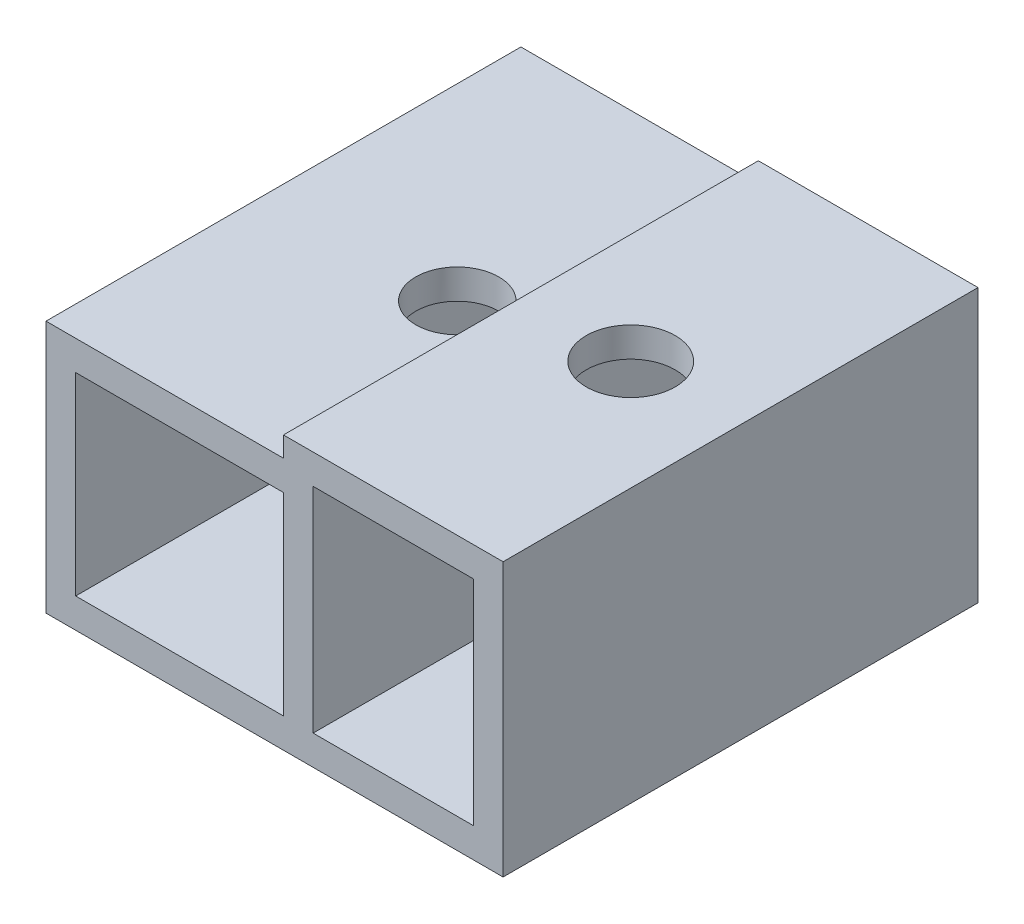
from build123d import *

# Parameters (mm, degrees)
SKETCH1_W           = 44.45
SKETCH1_H           = 41.402
SKETCH1_W_2         = 34.29
SKETCH1_H_2         = 45.72
BOSS_EXTRUDE1_DEPTH = 101.6
SKETCH2_R           = 9.525
CUT_EXTRUDE1_DEPTH  = 12.7
SKETCH3_R           = 8.89
CUT_EXTRUDE2_DEPTH  = 12.7
SKETCH4_R           = 8.5725
CUT_EXTRUDE3_DEPTH  = 12.7


with BuildPart() as part:
    # Sketch1 → Boss-Extrude1 (new body)
    with BuildSketch(Plane.XY):
        Polygon((0, 0), (97.79, 0), (97.79, 58.42), (50.8, 58.42), (50.8, 54.102), (0, 54.102), align=None)
        with Locations((28.575, 27.051)):
            Rectangle(SKETCH1_W, SKETCH1_H, mode=Mode.SUBTRACT)
        with Locations((74.295, 29.21)):
            Rectangle(SKETCH1_W_2, SKETCH1_H_2, mode=Mode.SUBTRACT)
    extrude(amount=BOSS_EXTRUDE1_DEPTH)

    # Sketch2 → Cut-Extrude1 (cut)
    with BuildSketch(Plane(origin=(0, 58.42, 0), x_dir=(1, 0, 0), z_dir=(0, 1, 0))):
        with Locations(Location((74.295, -50.8, 0), (0, 0, 180))):
            Circle(SKETCH2_R)
    extrude(amount=-CUT_EXTRUDE1_DEPTH, mode=Mode.SUBTRACT)

    # Sketch3 → Cut-Extrude2 (cut)
    with BuildSketch(Plane(origin=(0, 54.102, 0), x_dir=(1, 0, 0), z_dir=(0, 1, 0))):
        with Locations(Location((40.240640863, -53.848, 0), (0, 0, 270))):
            Circle(SKETCH3_R)
    extrude(amount=-CUT_EXTRUDE2_DEPTH, mode=Mode.SUBTRACT)

    # Sketch4 → Cut-Extrude3 (cut)
    with BuildSketch(Plane(origin=(0, 6.35, 0), x_dir=(1, 0, 0), z_dir=(0, 1, 0))):
        with Locations(Location((40.132, -53.848, 0), (0, 0, 270))):
            Circle(SKETCH4_R)
    extrude(amount=-CUT_EXTRUDE3_DEPTH, mode=Mode.SUBTRACT)


solid = part.part
